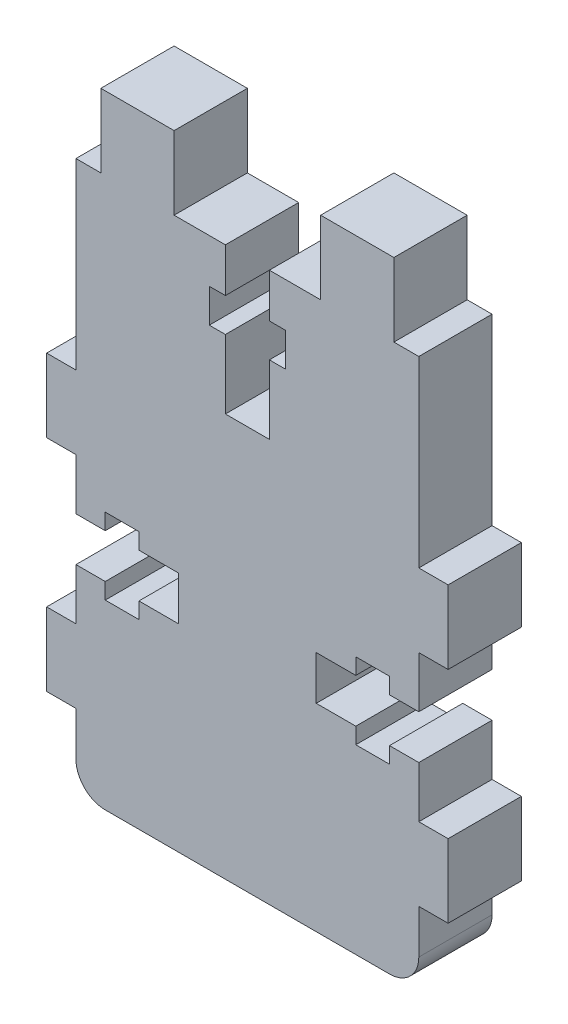
from build123d import *

# Parameters (mm, degrees)
BOSS_EXTRU_1_DEPTH = 5
FILLET1_R          = 2


with BuildPart() as part:
    # Esquisse1 → Boss.-Extru.1 (new body)
    with BuildSketch(Plane.XY):
        Polygon((1.7, 42.5), (1.7, 37.5), (0, 37.5), (0, 25), (-2, 25), (-2, 20), (0, 20), (0, 16.5), (2, 16.5), (2, 17.6), (4.3, 17.6), (4.3, 16.5), (7, 16.5), (7, 13.5), (4.3, 13.5), (4.3, 12.4), (2, 12.4), (2, 13.5), (0, 13.5), (0, 10), (-2, 10), (-2, 5), (0, 5), (0, 0), (23.4, 0), (23.4, 5), (25.4, 5), (25.4, 10), (23.4, 10), (23.4, 13.5), (21.4, 13.5), (21.4, 12.4), (19.1, 12.4), (19.1, 13.5), (16.4, 13.5), (16.4, 16.5), (19.1, 16.5), (19.1, 17.6), (21.4, 17.6), (21.4, 16.5), (23.4, 16.5), (23.4, 20), (25.4, 20), (25.4, 25), (23.4, 25), (23.4, 37.5), (21.7, 37.5), (21.7, 42.5), (16.7, 42.5), (16.7, 37.5), (13.2, 37.5), (13.2, 34.5), (14.3, 34.5), (14.3, 32.2), (13.2, 32.2), (13.2, 27.5), (10.2, 27.5), (10.2, 32.2), (9.1, 32.2), (9.1, 34.5), (10.2, 34.5), (10.2, 37.5), (6.7, 37.5), (6.7, 42.5), align=None)
    extrude(amount=BOSS_EXTRU_1_DEPTH)

    # Fillet1
    fillet1_edges = [part.edges().sort_by_distance(p)[0] for p in [
        (23.4, 0, 2.5),
        (0, 0, 2.5),
    ]]
    fillet(fillet1_edges, radius=FILLET1_R)


solid = part.part
